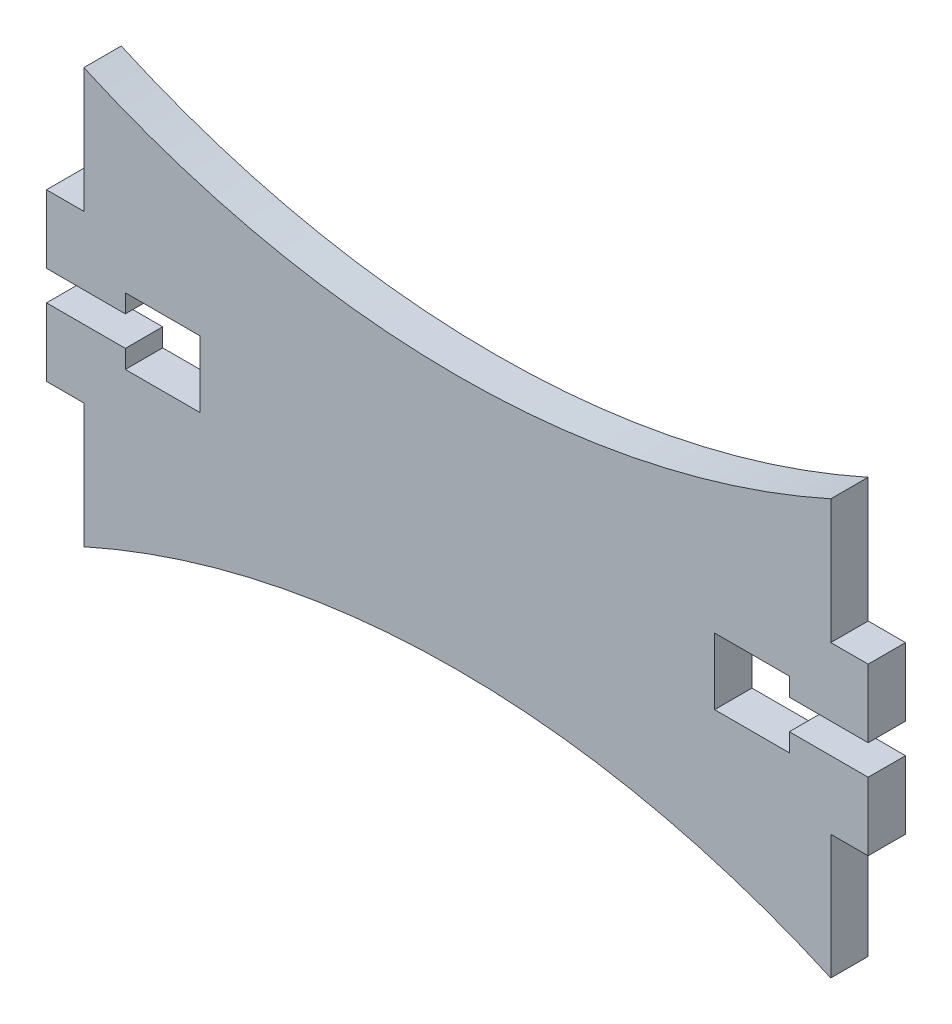
from build123d import *

# Parameters (mm, degrees)
BOSS_EXTRUDE1_DEPTH = 4.5


with BuildPart() as part:
    # Sketch1 → Boss-Extrude1 (new body)
    with BuildSketch(Plane.XY):
        with BuildLine():
            Line((-49.5, -1.8), (-49.5, -10))
            Line((-49.5, -10), (-45, -10))
            Line((-45, -10), (-45, -25))
            ThreePointArc((-45, -25), (0, -15.341439003), (45, -25))
            Line((45, -25), (45, -10))
            Line((45, -10), (49.5, -10))
            Line((49.5, -10), (49.5, -1.8))
            Line((49.5, -1.8), (40, -1.8))
            Line((40, -1.8), (40, -4))
            Line((40, -4), (31, -4))
            Line((31, -4), (31, 4))
            Line((31, 4), (40, 4))
            Line((40, 4), (40, 1.8))
            Line((40, 1.8), (49.5, 1.8))
            Line((49.5, 1.8), (49.5, 10))
            Line((49.5, 10), (45, 10))
            Line((45, 10), (45, 25))
            ThreePointArc((45, 25), (0, 15.341439003), (-45, 25))
            Line((-45, 25), (-45, 10))
            Line((-45, 10), (-49.5, 10))
            Line((-49.5, 10), (-49.5, 1.8))
            Line((-49.5, 1.8), (-40, 1.8))
            Line((-40, 1.8), (-40, 4))
            Line((-40, 4), (-31, 4))
            Line((-31, 4), (-31, -4))
            Line((-31, -4), (-40, -4))
            Line((-40, -4), (-40, -1.8))
            Line((-40, -1.8), (-49.5, -1.8))
        make_face()
    extrude(amount=BOSS_EXTRUDE1_DEPTH)


solid = part.part
